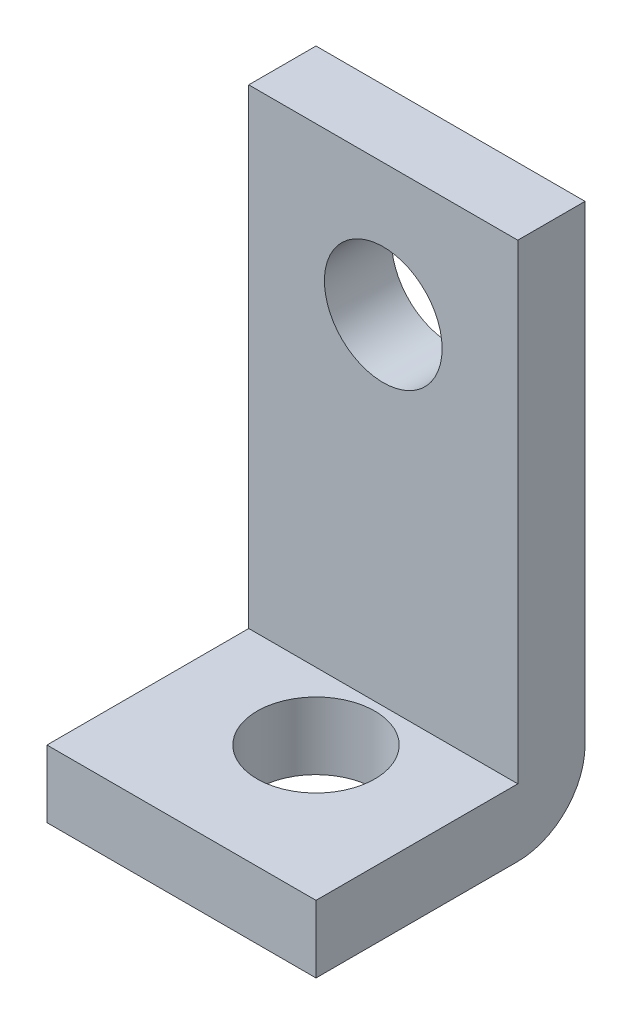
from build123d import *

# Parameters (mm, degrees)
SKETCH1_W           = 10.16
SKETCH1_H           = 7.62
SKETCH1_R           = 2.2225
BOSS_EXTRUDE1_DEPTH = 2.54
SKETCH1_4_W         = 10.16
SKETCH1_4_H         = 2.54
BOSS_EXTRUDE2_DEPTH = 20.32
FILLET1_R           = 2.54
CUT_EXTRUDE1_REACH  = 24.288
SKETCH2_R           = 2.2225


with BuildPart() as part:
    # Sketch1 → Boss-Extrude1 (new body)
    with BuildSketch(Plane(origin=(0, 0, 0), x_dir=(1, 0, 0), z_dir=(0, 1, 0))):
        with Locations((0, -1.27)):
            Rectangle(SKETCH1_W, SKETCH1_H)
        Circle(SKETCH1_R, mode=Mode.SUBTRACT)
    extrude(amount=BOSS_EXTRUDE1_DEPTH)

    # Sketch1<4> → Boss-Extrude2 (add)
    with BuildSketch(Plane(origin=(0, 0, 0), x_dir=(1, 0, 0), z_dir=(0, 1, 0))):
        with Locations((0, 3.81)):
            Rectangle(SKETCH1_4_W, SKETCH1_4_H)
    extrude(amount=BOSS_EXTRUDE2_DEPTH)

    # Fillet1
    fillet1_edges = [part.edges().sort_by_distance(p)[0] for p in [
        (0, 0, -5.08),
    ]]
    fillet(fillet1_edges, radius=FILLET1_R)

    # Sketch2 → Cut-Extrude1 (cut, up to next)
    with BuildSketch(Plane.XY.offset(-2.54), mode=Mode.PRIVATE) as cut_extrude1_sk1:
        with Locations((0, 15.3416)):
            Circle(SKETCH2_R)
    cut_extrude1_tool1 = extrude(cut_extrude1_sk1.sketch, amount=-CUT_EXTRUDE1_REACH, mode=Mode.PRIVATE) & part.part
    add(cut_extrude1_tool1.solids().sort_by_distance((0, 15.3416, -2.54))[0], mode=Mode.SUBTRACT)


solid = part.part
